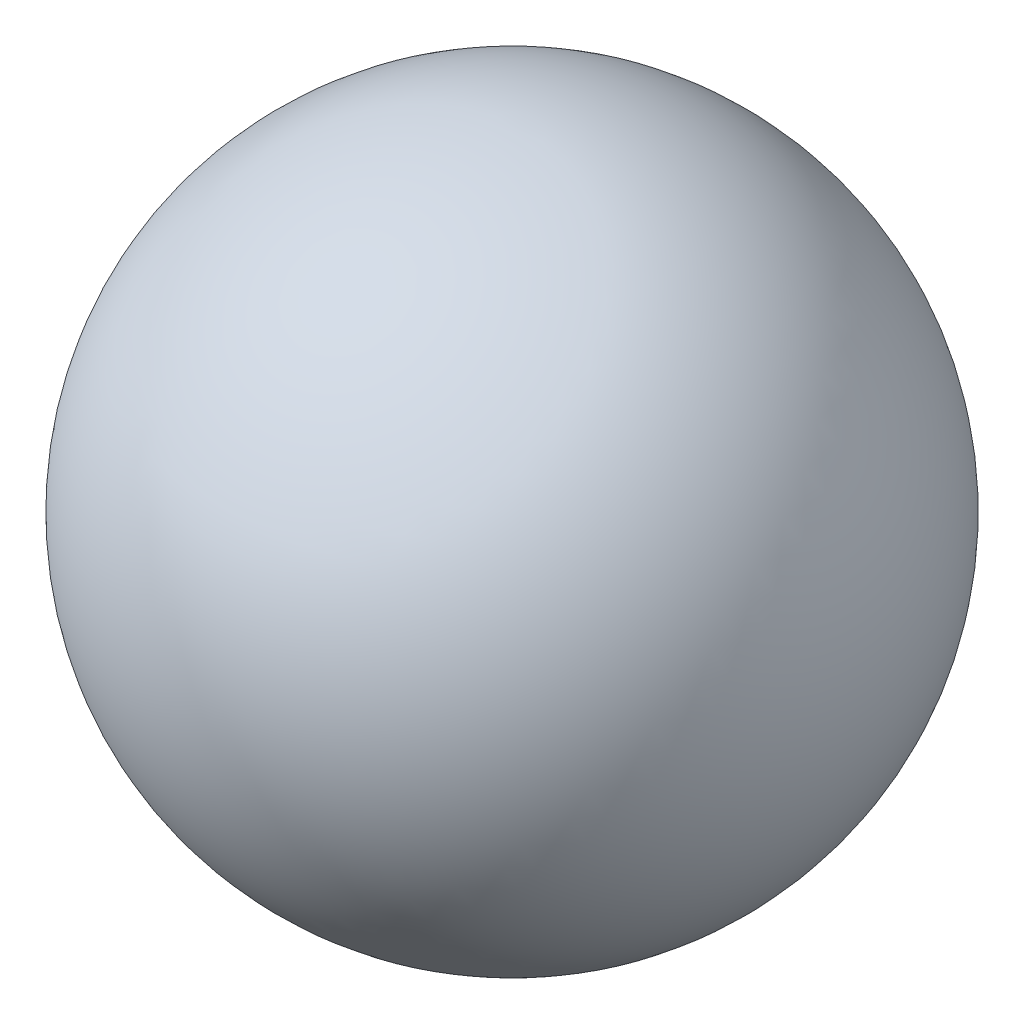
from build123d import *


with BuildPart() as part:
    # Sketch1 → Revolve1 (revolve)
    with BuildSketch(Plane.XY):
        with BuildLine():
            Line((0, 35), (0, -35))
            ThreePointArc((0, -35), (-35, 0), (0, 35))
        make_face()
    revolve(axis=Axis((0, 35, 0), (0, -1, 0)))


solid = part.part
